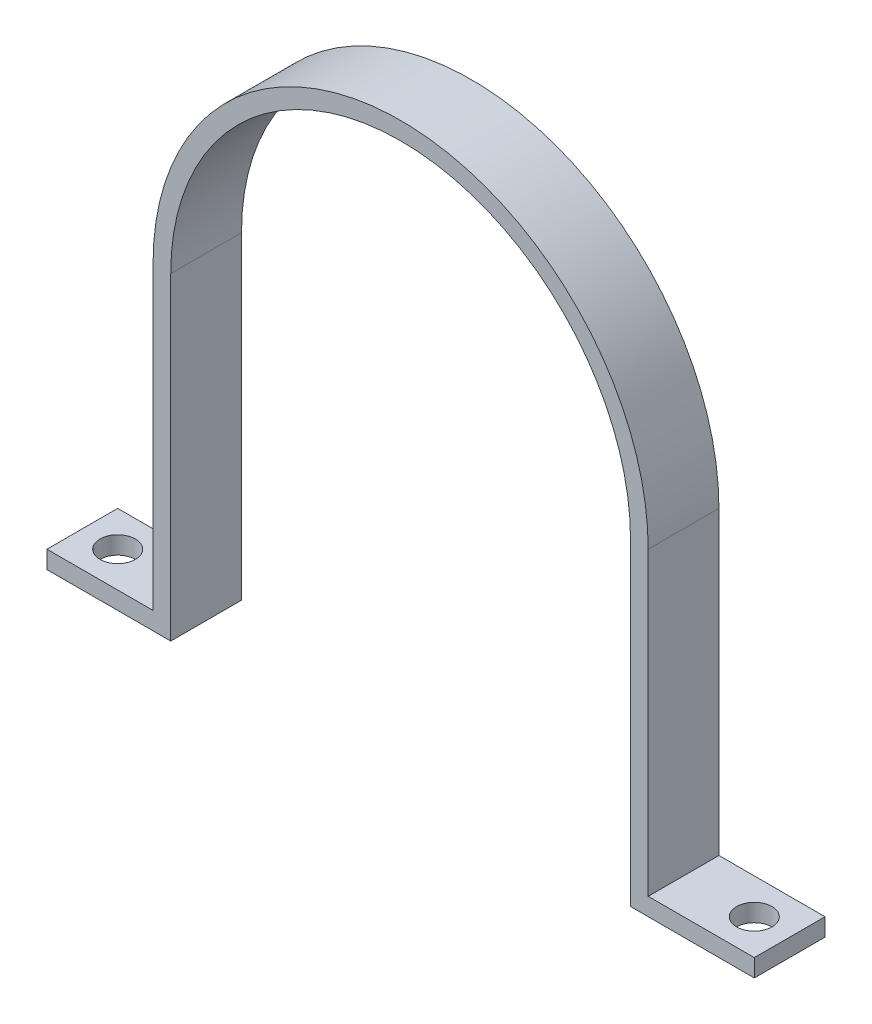
from build123d import *

# Parameters (mm, degrees)
BOSS_EXTRUDE1_DEPTH         = 8
TAP_DRILL_FOR_M4X0_7_TAP1_D = 3.3
SKETCH4_R                   = 2
CUT_EXTRUDE1_DEPTH          = 75.215901261


with BuildPart() as part:
    # Sketch3 → Boss-Extrude1 (new body)
    with BuildSketch(Plane.XY):
        with BuildLine():
            Line((28, 0), (28, -34))
            Line((28, -34), (40, -34))
            Line((40, -34), (40, -36))
            Line((40, -36), (26, -36))
            Line((26, -36), (26, 0))
            ThreePointArc((26, 0), (0, 26), (-26, 0))
            Line((-26, 0), (-26, -36))
            Line((-26, -36), (-40, -36))
            Line((-40, -36), (-40, -34))
            Line((-40, -34), (-28, -34))
            Line((-28, -34), (-28, 0))
            ThreePointArc((-28, 0), (0, 28), (28, 0))
        make_face()
    extrude(amount=BOSS_EXTRUDE1_DEPTH)

    # Tap Drill for M4x0.7 Tap1 (through all)
    with Locations(Plane(origin=(0, -34, 0), x_dir=(1, 0, 0), z_dir=(0, 1, 0))):
        with Locations((-36, -4), (36, -4)):
            Hole(TAP_DRILL_FOR_M4X0_7_TAP1_D / 2)

    # Sketch4 → Cut-Extrude1 (cut, through all)
    with BuildSketch(Plane(origin=(0, -34, 0), x_dir=(1, 0, 0), z_dir=(0, 1, 0))):
        with Locations(Location((-36, -4, 0), (0, 0, 270))):
            Circle(SKETCH4_R)
        with Locations(Location((36, -4, 0), (0, 0, 270))):
            Circle(SKETCH4_R)
    extrude(amount=-CUT_EXTRUDE1_DEPTH, mode=Mode.SUBTRACT)


solid = part.part
